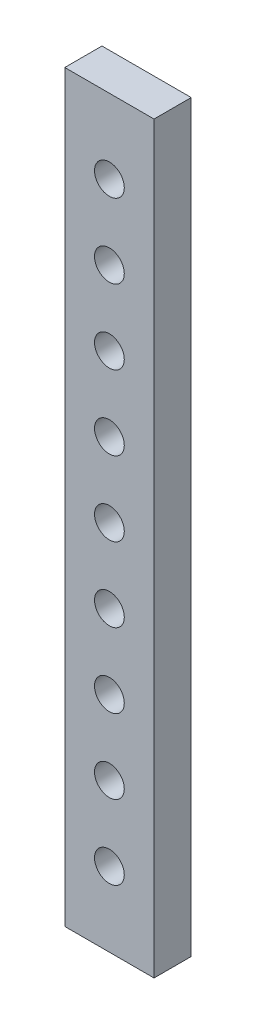
from build123d import *

# Parameters (mm, degrees)
SKETCH1_W           = 12
SKETCH1_H           = 100
SKETCH1_R           = 2
BOSS_EXTRUDE1_DEPTH = 5


with BuildPart() as part:
    # Sketch1 → Boss-Extrude1 (new body)
    with BuildSketch(Plane.XY):
        Rectangle(SKETCH1_W, SKETCH1_H)
        Circle(SKETCH1_R, mode=Mode.SUBTRACT)
        with Locations((0, 10)):
            Circle(SKETCH1_R, mode=Mode.SUBTRACT)
        with Locations((0, 20)):
            Circle(SKETCH1_R, mode=Mode.SUBTRACT)
        with Locations((0, 30)):
            Circle(SKETCH1_R, mode=Mode.SUBTRACT)
        with Locations((0, 40)):
            Circle(SKETCH1_R, mode=Mode.SUBTRACT)
        with Locations((0, -10)):
            Circle(SKETCH1_R, mode=Mode.SUBTRACT)
        with Locations((0, -20)):
            Circle(SKETCH1_R, mode=Mode.SUBTRACT)
        with Locations((0, -30)):
            Circle(SKETCH1_R, mode=Mode.SUBTRACT)
        with Locations((0, -40)):
            Circle(SKETCH1_R, mode=Mode.SUBTRACT)
    extrude(amount=BOSS_EXTRUDE1_DEPTH)


solid = part.part
